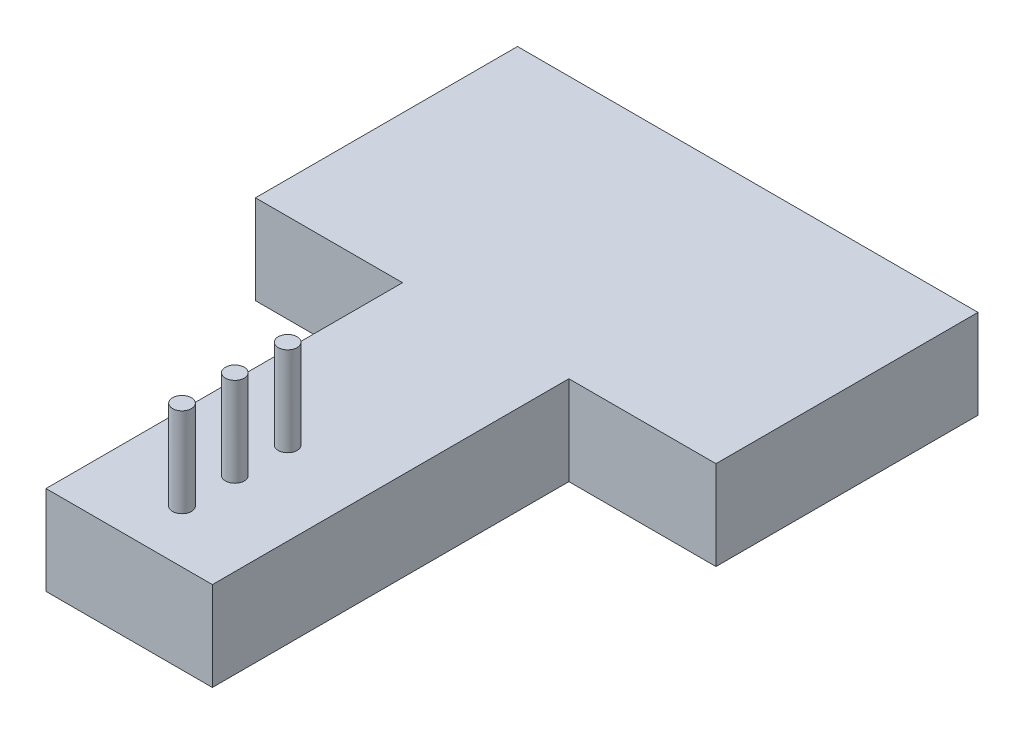
from build123d import *

# Parameters (mm, degrees)
BOSS_EXTRUDE1_DEPTH = 30
SKETCH2_R           = 3.175
BOSS_EXTRUDE2_DEPTH = 30


with BuildPart() as part:
    # Sketch1 → Boss-Extrude1 (new body)
    with BuildSketch(Plane(origin=(0, 0, 0), x_dir=(1, 0, 0), z_dir=(0, 1, 0))):
        Polygon((28, 0), (77.5, 0), (77.5, 88.2), (-77.5, 88.2), (-77.5, 0), (-28, 0), (-28, -120), (28, -120), align=None)
    extrude(amount=-BOSS_EXTRUDE1_DEPTH)

    # Sketch2 → Boss-Extrude2 (add)
    with BuildSketch(Plane(origin=(0, 0, 0), x_dir=(1, 0, 0), z_dir=(0, 1, 0))):
        with Locations(Location((0, -84.44, 0), (0, 0, 90))):
            Circle(SKETCH2_R)
        with Locations(Location((0, -66.66, 0), (0, 0, 90))):
            Circle(SKETCH2_R)
        with Locations(Location((0, -102.22, 0), (0, 0, 90))):
            Circle(SKETCH2_R)
    extrude(amount=BOSS_EXTRUDE2_DEPTH)


solid = part.part
